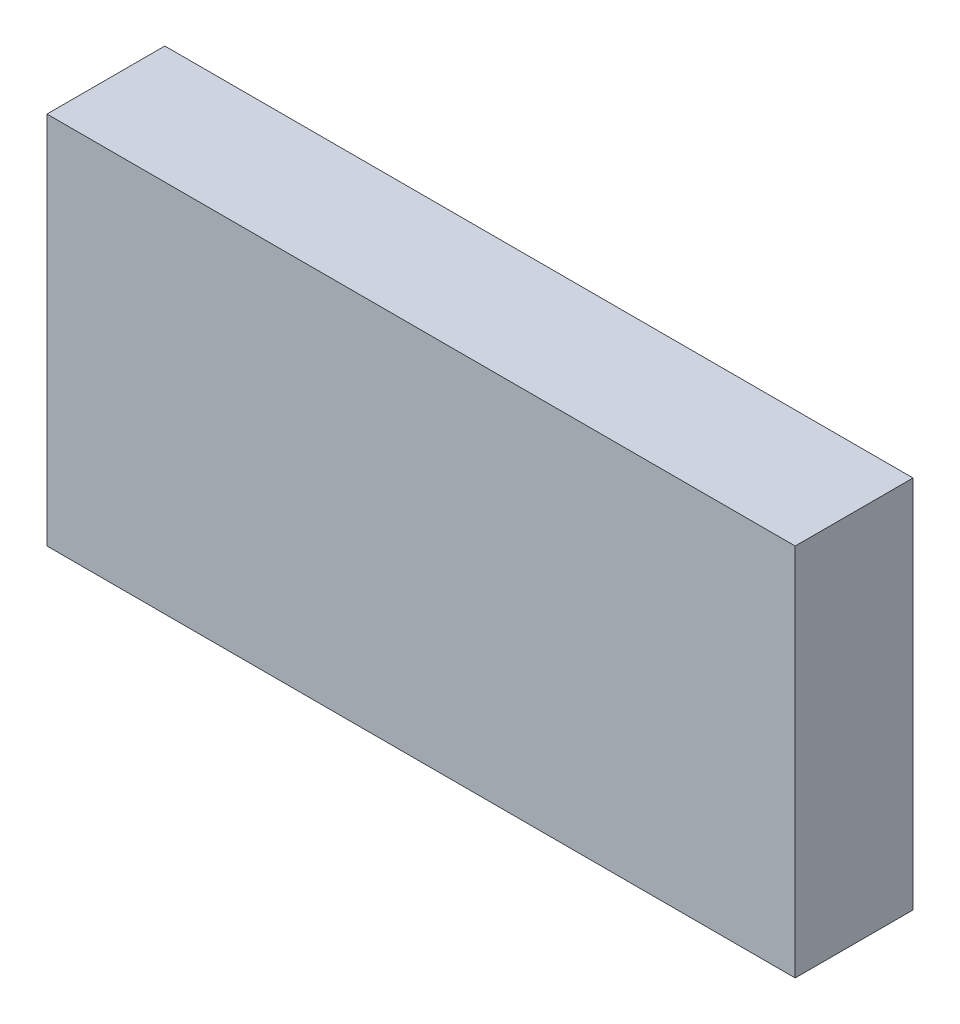
from build123d import *

# Parameters (mm, degrees)
SKETCH1_W           = 40
SKETCH1_H           = 20
BOSS_EXTRUDE1_DEPTH = 6.3


with BuildPart() as part:
    # Sketch1 → Boss-Extrude1 (new body)
    with BuildSketch(Plane.XY):
        with Locations((20, 10)):
            Rectangle(SKETCH1_W, SKETCH1_H)
    extrude(amount=BOSS_EXTRUDE1_DEPTH)


solid = part.part
